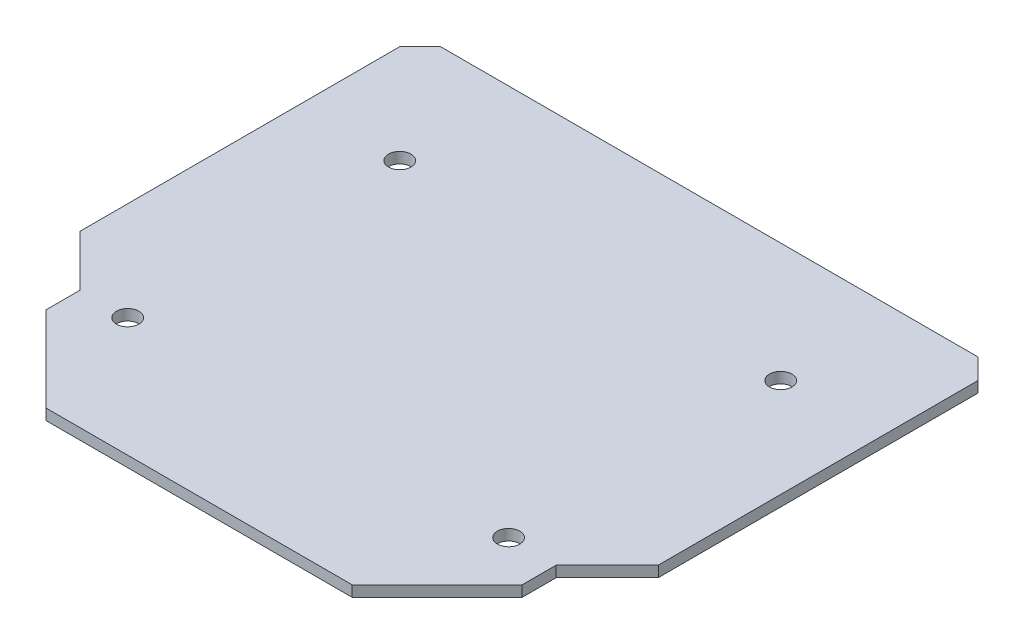
from build123d import *

# Parameters (mm, degrees)
SKETCH_1_W          = 85
SKETCH_1_H          = 75
EXTRUDE_1_DEPTH     = 1.6
CUT_EXTRUDE_1_REACH = 58.701
SKETCH_2_R          = 1.65
CHAMFER_2_SIZE      = 3
CHAMFER_3_SIZE      = 20
CUT_EXTRUDE_4_REACH = 58.701


with BuildPart() as part:
    # 草图1 → 凸台-拉伸1 (new body)
    with BuildSketch(Plane(origin=(0, 0, 0), x_dir=(1, 0, 0), z_dir=(0, 1, 0))):
        Rectangle(SKETCH_1_W, SKETCH_1_H)
    extrude(amount=EXTRUDE_1_DEPTH)

    # 草图2 → 切除-拉伸1 (cut, up to next)
    with BuildSketch(Plane(origin=(0, 1.6, 0), x_dir=(1, 0, 0), z_dir=(0, 1, 0)), mode=Mode.PRIVATE) as cut_extrude_1_sk1:
        with Locations(Location((-28, 20, 0), (0, 0, 270))):
            Circle(SKETCH_2_R)
    cut_extrude_1_tool1 = extrude(cut_extrude_1_sk1.sketch, amount=-CUT_EXTRUDE_1_REACH, mode=Mode.PRIVATE) & part.part
    # 草图2 → 切除-拉伸1 (cut, up to next)
    with BuildSketch(Plane(origin=(0, 1.6, 0), x_dir=(1, 0, 0), z_dir=(0, 1, 0)), mode=Mode.PRIVATE) as cut_extrude_1_sk2:
        with Locations(Location((-28, -20, 0), (0, 0, 270))):
            Circle(SKETCH_2_R)
    cut_extrude_1_tool2 = extrude(cut_extrude_1_sk2.sketch, amount=-CUT_EXTRUDE_1_REACH, mode=Mode.PRIVATE) & part.part
    # 草图2 → 切除-拉伸1 (cut, up to next)
    with BuildSketch(Plane(origin=(0, 1.6, 0), x_dir=(1, 0, 0), z_dir=(0, 1, 0)), mode=Mode.PRIVATE) as cut_extrude_1_sk3:
        with Locations(Location((28, 20, 0), (0, 0, 270))):
            Circle(SKETCH_2_R)
    cut_extrude_1_tool3 = extrude(cut_extrude_1_sk3.sketch, amount=-CUT_EXTRUDE_1_REACH, mode=Mode.PRIVATE) & part.part
    # 草图2 → 切除-拉伸1 (cut, up to next)
    with BuildSketch(Plane(origin=(0, 1.6, 0), x_dir=(1, 0, 0), z_dir=(0, 1, 0)), mode=Mode.PRIVATE) as cut_extrude_1_sk4:
        with Locations(Location((28, -20, 0), (0, 0, 270))):
            Circle(SKETCH_2_R)
    cut_extrude_1_tool4 = extrude(cut_extrude_1_sk4.sketch, amount=-CUT_EXTRUDE_1_REACH, mode=Mode.PRIVATE) & part.part
    add(cut_extrude_1_tool1.solids().sort_by_distance((-28, 1.6, -20))[0], mode=Mode.SUBTRACT)
    add(cut_extrude_1_tool2.solids().sort_by_distance((-28, 1.6, 20))[0], mode=Mode.SUBTRACT)
    add(cut_extrude_1_tool3.solids().sort_by_distance((28, 1.6, -20))[0], mode=Mode.SUBTRACT)
    add(cut_extrude_1_tool4.solids().sort_by_distance((28, 1.6, 20))[0], mode=Mode.SUBTRACT)

    # 倒角2
    chamfer_2_edges = [part.edges().sort_by_distance(p)[0] for p in [
        (-42.5, 0.8, -37.5),
        (42.5, 0.8, -37.5),
    ]]
    chamfer(chamfer_2_edges, length=CHAMFER_2_SIZE)

    # 倒角3
    chamfer_3_edges = [part.edges().sort_by_distance(p)[0] for p in [
        (42.5, 0.8, 37.5),
        (-42.5, 0.8, 37.5),
    ]]
    chamfer(chamfer_3_edges, length=CHAMFER_3_SIZE)

    # 草图7 → 切除-拉伸4 (cut, up to next)
    with BuildSketch(Plane(origin=(0, 1.6, 0), x_dir=(1, 0, 0), z_dir=(0, 1, 0)), mode=Mode.PRIVATE) as cut_extrude_4_sk1:
        Polygon((-35, -25), (-35, -20), (-42.5, -12.5), (-42.5, -17.5), align=None)
    cut_extrude_4_tool1 = extrude(cut_extrude_4_sk1.sketch, amount=-CUT_EXTRUDE_4_REACH, mode=Mode.PRIVATE) & part.part
    cut_extrude_4 = cut_extrude_4_tool1.solids().sort_by_distance((-38.75, 1.6, 18.75))[0]
    add(cut_extrude_4, mode=Mode.SUBTRACT)

    # 镜向1: 切除-拉伸4 across plane
    add(cut_extrude_4.mirror(Plane(origin=(0, 0, 0), x_dir=(0, 0, 1), z_dir=(1, 0, 0))), mode=Mode.SUBTRACT)


solid = part.part
